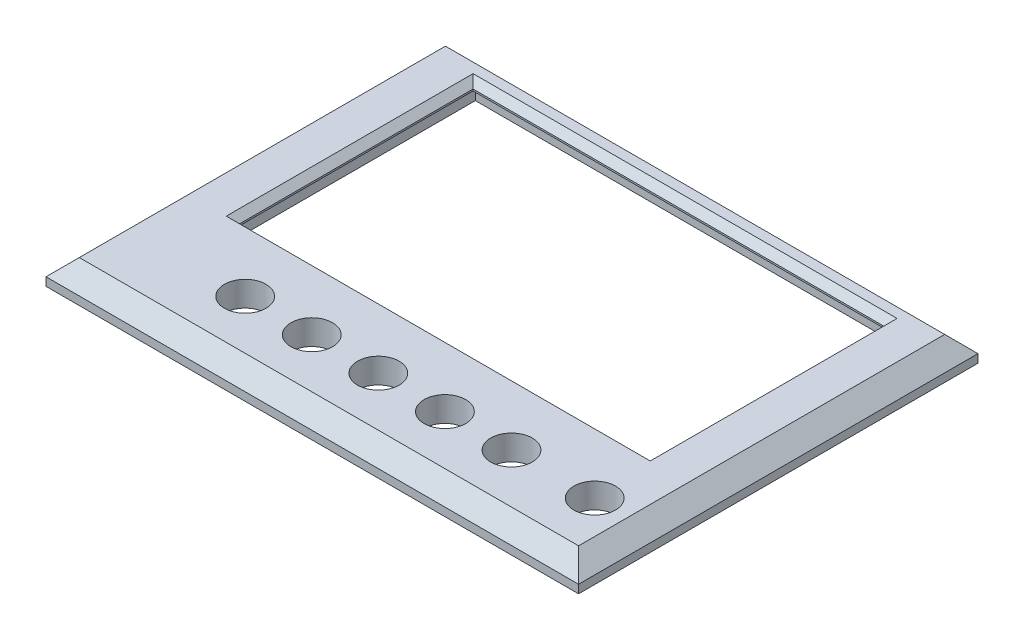
from build123d import *

# Parameters (mm, degrees)
SKETCH1_W           = 203.2
SKETCH1_H           = 152.4
BOSS_EXTRUDE1_DEPTH = 9.525
SKETCH2_W           = 156.7
SKETCH2_H           = 89.1
CUT_EXTRUDE1_DEPTH  = 128.356686613
CHAMFER1_SIZE       = 2.54
SKETCH3_W           = 164.9
SKETCH3_H           = 100
CUT_EXTRUDE2_DEPTH  = 6.35
SKETCH4_R           = 7.9375
CUT_EXTRUDE3_DEPTH  = 128.356686613
CHAMFER2_SIZE       = 6.35


with BuildPart() as part:
    # Sketch1 → Boss-Extrude1 (new body)
    with BuildSketch(Plane(origin=(0, 0, 0), x_dir=(1, 0, 0), z_dir=(0, 1, 0))):
        Rectangle(SKETCH1_W, SKETCH1_H)
    extrude(amount=BOSS_EXTRUDE1_DEPTH)

    # Sketch2 → Cut-Extrude1 (cut, through all)
    with BuildSketch(Plane(origin=(0, 9.525, 0), x_dir=(1, 0, 0), z_dir=(0, 1, 0))):
        with Locations((0, 18.95)):
            Rectangle(SKETCH2_W, SKETCH2_H)
    extrude(amount=-CUT_EXTRUDE1_DEPTH, mode=Mode.SUBTRACT)

    # Chamfer1
    chamfer1_edges = [part.edges().sort_by_distance(p)[0] for p in [
        (78.35, 9.525, -18.95),
        (0, 9.525, -63.5),
        (-78.35, 9.525, -18.95),
        (0, 9.525, 25.6),
    ]]
    chamfer(chamfer1_edges, length=CHAMFER1_SIZE)

    # Sketch3 → Cut-Extrude2 (cut)
    with BuildSketch(Plane(origin=(-44.720558265, 0, -165.453357273), x_dir=(1, 0, 0), z_dir=(0, -1, 0))):
        with Locations((46.110558265, 148.383357273)):
            Rectangle(SKETCH3_W, SKETCH3_H)
    extrude(amount=-CUT_EXTRUDE2_DEPTH, mode=Mode.SUBTRACT)

    # Sketch4 → Cut-Extrude3 (cut, through all)
    with BuildSketch(Plane(origin=(0, 9.525, 0), x_dir=(1, 0, 0), z_dir=(0, 1, 0))):
        with Locations(Location((-50.8, -51, 0), (0, 0, 270))):
            Circle(SKETCH4_R)
        with Locations(Location((-25.4, -51, 0), (0, 0, 270))):
            Circle(SKETCH4_R)
        with Locations(Location((0, -51, 0), (0, 0, 270))):
            Circle(SKETCH4_R)
        with Locations(Location((25.4, -51, 0), (0, 0, 270))):
            Circle(SKETCH4_R)
        with Locations(Location((50.8, -51, 0), (0, 0, 270))):
            Circle(SKETCH4_R)
        with Locations(Location((82.55, -51, 0), (0, 0, 270))):
            Circle(SKETCH4_R)
    extrude(amount=-CUT_EXTRUDE3_DEPTH, mode=Mode.SUBTRACT)

    # Chamfer2
    chamfer2_edges = [part.edges().sort_by_distance(p)[0] for p in [
        (-101.6, 9.525, 0),
        (0, 9.525, 76.2),
        (101.6, 9.525, 0),
        (0, 9.525, -76.2),
    ]]
    chamfer(chamfer2_edges, length=CHAMFER2_SIZE)


solid = part.part
